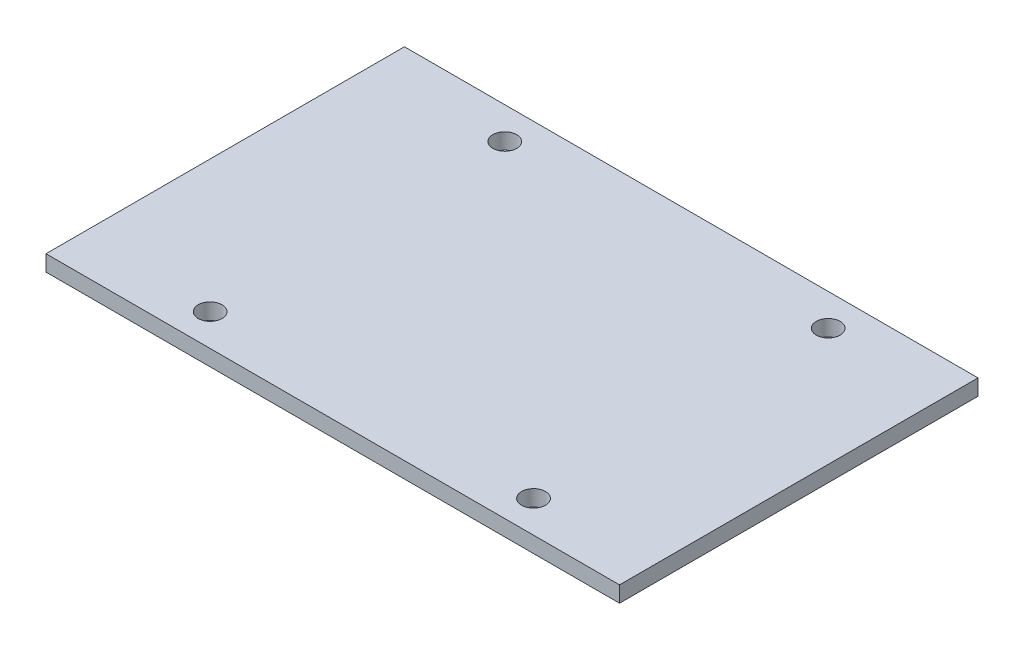
from build123d import *

# Parameters (mm, degrees)
SKETCH1_W           = 72
SKETCH1_H           = 45
BOSS_EXTRUDE1_DEPTH = 2
SKETCH2_R           = 1.5
CUT_EXTRUDE1_DEPTH  = 2


with BuildPart() as part:
    # Sketch1 → Boss-Extrude1 (new body)
    with BuildSketch(Plane(origin=(0, 0, 0), x_dir=(1, 0, 0), z_dir=(0, 1, 0))):
        Rectangle(SKETCH1_W, SKETCH1_H)
    extrude(amount=BOSS_EXTRUDE1_DEPTH)

    # Sketch2 → Cut-Extrude1 (cut)
    with BuildSketch(Plane(origin=(0, 2, 0), x_dir=(1, 0, 0), z_dir=(0, 1, 0))):
        with Locations(Location((21.2, 18.495, 0), (0, 0, 270))):
            Circle(SKETCH2_R)
        with Locations(Location((21.2, -18.495, 0), (0, 0, 270))):
            Circle(SKETCH2_R)
        with Locations(Location((-19.4, -18.495, 0), (0, 0, 270))):
            Circle(SKETCH2_R)
        with Locations(Location((-19.4, 18.495, 0), (0, 0, 270))):
            Circle(SKETCH2_R)
    extrude(amount=-CUT_EXTRUDE1_DEPTH, mode=Mode.SUBTRACT)


solid = part.part
